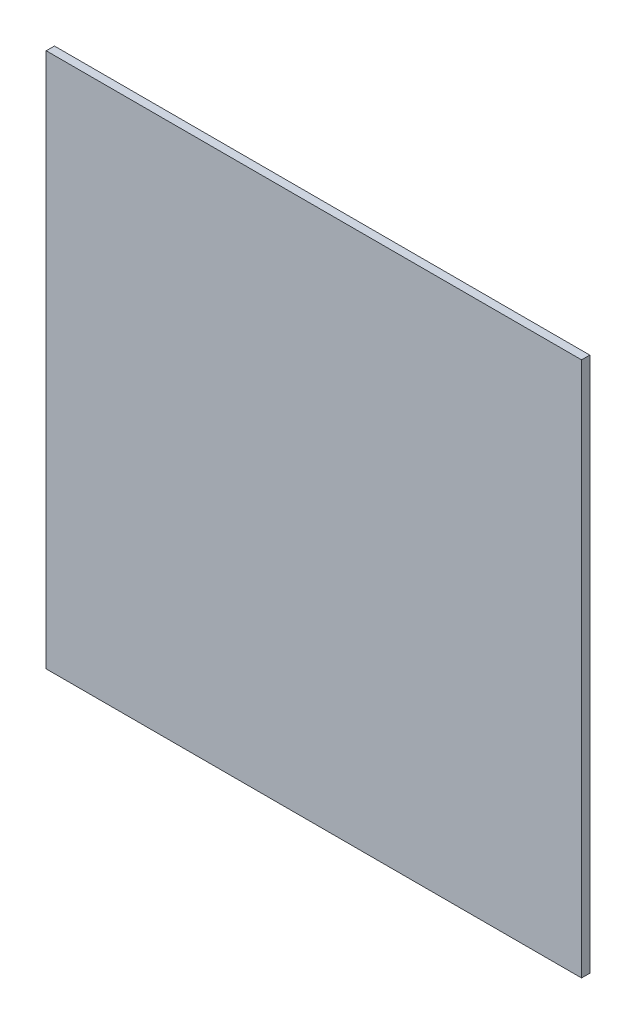
from build123d import *

# Parameters (mm, degrees)
ESBO_O1_W                = 32.5
ESBO_O1_H                = 32.5
RESSALTO_EXTRUS_O1_DEPTH = 0.5


with BuildPart() as part:
    # Esboço1 → Ressalto-extrusão1 (new body)
    with BuildSketch(Plane.XY):
        with Locations((-1.45212766, 1.936170213)):
            Rectangle(ESBO_O1_W, ESBO_O1_H)
    extrude(amount=RESSALTO_EXTRUS_O1_DEPTH)


solid = part.part
